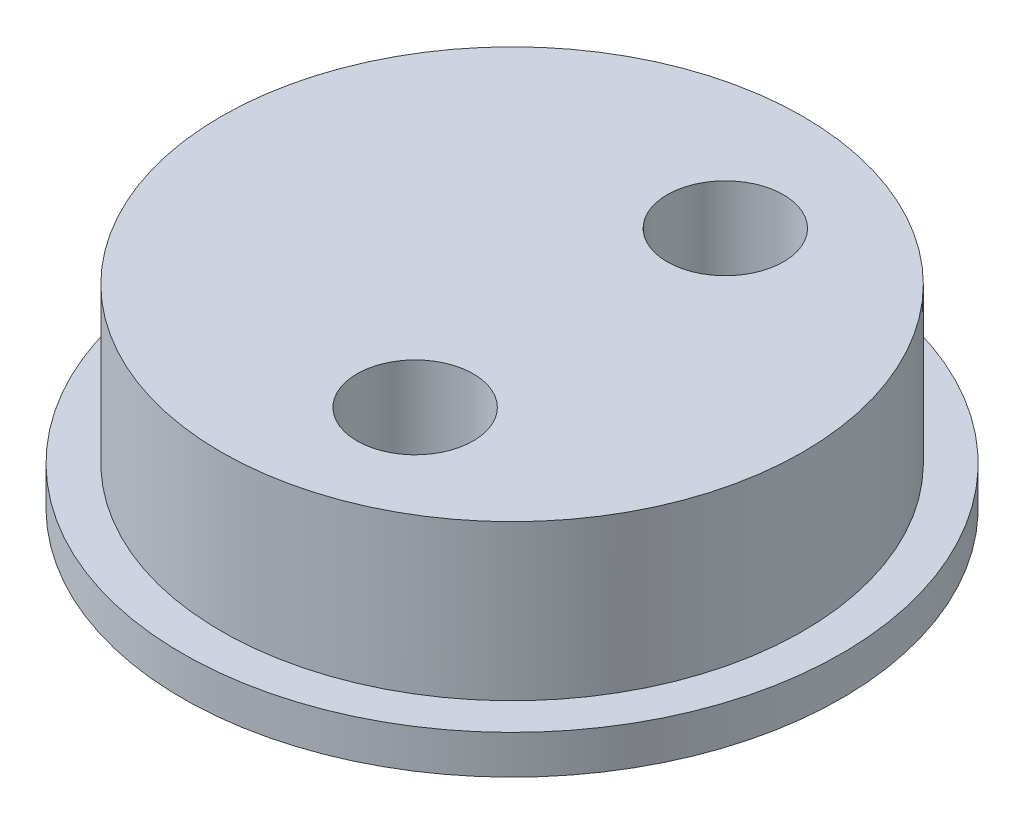
from build123d import *

# Parameters (mm, degrees)
SKETCH1_R           = 7.5
BOSS_EXTRUDE1_DEPTH = 5
SKETCH2_R           = 8.5
BOSS_EXTRUDE2_DEPTH = 1
SKETCH4_R           = 1.5
CUT_EXTRUDE1_DEPTH  = 15.044571905


with BuildPart() as part:
    # Sketch1 → Boss-Extrude1 (new body)
    with BuildSketch(Plane(origin=(0, 0, 0), x_dir=(1, 0, 0), z_dir=(0, 1, 0))):
        with Locations(Location((-1.5, 0, 0), (0, 0, 270))):
            Circle(SKETCH1_R)
    extrude(amount=BOSS_EXTRUDE1_DEPTH)

    # Sketch2 → Boss-Extrude2 (add)
    with BuildSketch(Plane.XZ):
        with Locations(Location((-1.5, 0, 0), (0, 0, 270))):
            Circle(SKETCH2_R)
    extrude(amount=-BOSS_EXTRUDE2_DEPTH)

    # Sketch4 → Cut-Extrude1 (cut, through all)
    with BuildSketch(Plane(origin=(0, 5, 0), x_dir=(1, 0, 0), z_dir=(0, 1, 0))):
        with Locations(Location((0, 4, 0), (0, 0, 270))):
            Circle(SKETCH4_R)
        with Locations(Location((0, -4, 0), (0, 0, 270))):
            Circle(SKETCH4_R)
    extrude(amount=-CUT_EXTRUDE1_DEPTH, mode=Mode.SUBTRACT)


solid = part.part
